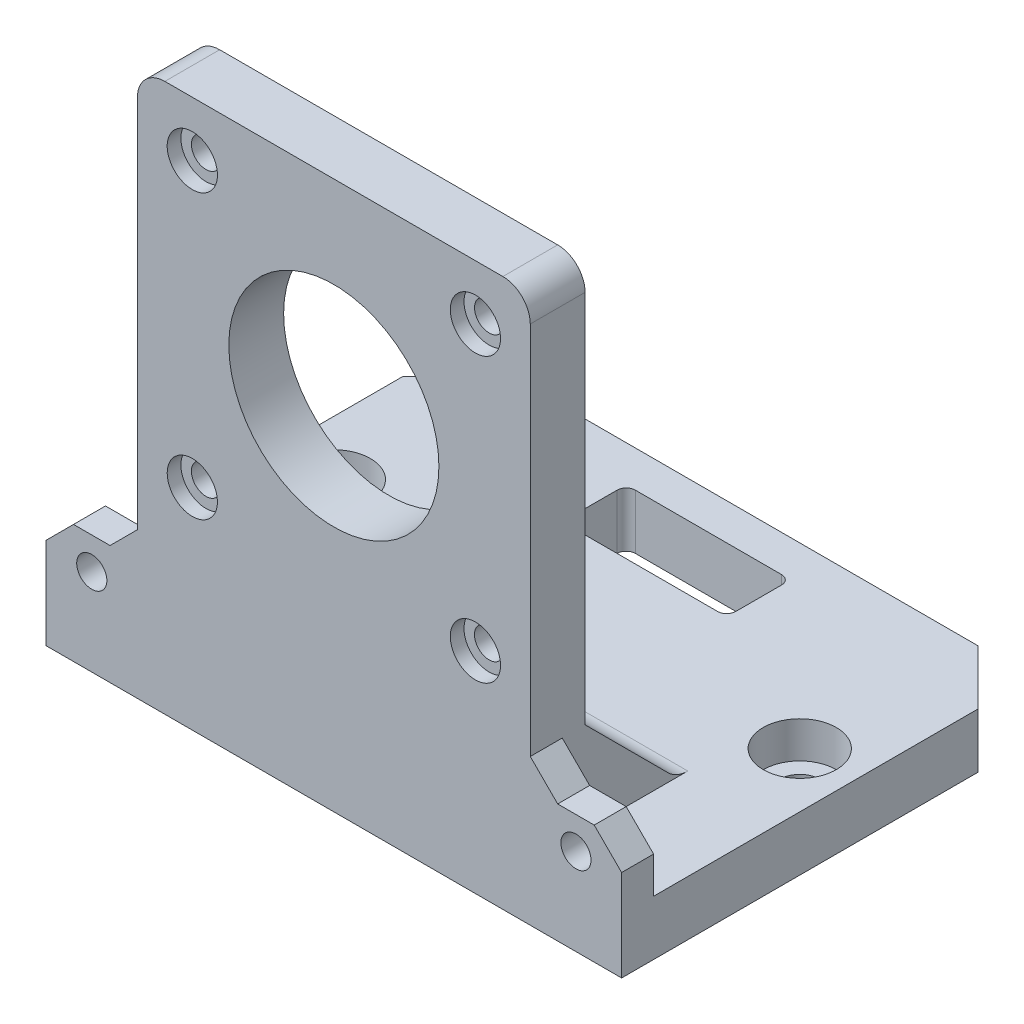
from build123d import *

# Parameters (mm, degrees)
SKETCH1_W           = 43
SKETCH1_H           = 54
SKETCH1_R           = 1.6
SKETCH1_R_2         = 11.5
BOSS_EXTRUDE1_DEPTH = 6
FILLET1_R           = 3
SKETCH2_W           = 63
SKETCH2_H           = 45
BOSS_EXTRUDE2_DEPTH = 6
SKETCH3_R           = 2.2
CUT_EXTRUDE1_DEPTH  = 10
CHAMFER6_SIZE       = 10
SKETCH7_R           = 2.75
CUT_EXTRUDE4_DEPTH  = 1.5
CHAMFER11_SIZE      = 6
SKETCH13_W          = 10
SKETCH13_H          = 3.5
BOSS_EXTRUDE7_DEPTH = 7
SKETCH14_R          = 1.65
CUT_EXTRUDE5_DEPTH  = 7
SKETCH15_W          = 18
SKETCH15_H          = 7
CUT_EXTRUDE6_DEPTH  = 7
FILLET9_R           = 1
FILLET10_R          = 3
SKETCH16_R          = 4
CUT_EXTRUDE7_DEPTH  = 4
CHAMFER12_SIZE      = 3


with BuildPart() as part:
    # Sketch1 → Boss-Extrude1 (new body)
    with BuildSketch(Plane.XY):
        with Locations((0, -5.5)):
            Rectangle(SKETCH1_W, SKETCH1_H)
        with Locations((-15.495, 15.495)):
            Circle(SKETCH1_R, mode=Mode.SUBTRACT)
        with Locations(Location((15.495, 15.495, 0), (0, 0, 180))):
            Circle(SKETCH1_R, mode=Mode.SUBTRACT)
        with Locations((15.495, -15.495)):
            Circle(SKETCH1_R, mode=Mode.SUBTRACT)
        with Locations(Location((-15.495, -15.495, 0), (0, 0, 180))):
            Circle(SKETCH1_R, mode=Mode.SUBTRACT)
        Circle(SKETCH1_R_2, mode=Mode.SUBTRACT)
    extrude(amount=BOSS_EXTRUDE1_DEPTH)

    # Fillet1
    fillet1_edges = [part.edges().sort_by_distance(p)[0] for p in [
        (-21.5, 21.5, 3),
        (21.5, 21.5, 3),
    ]]
    fillet(fillet1_edges, radius=FILLET1_R)

    # Sketch2 → Boss-Extrude2 (add)
    with BuildSketch(Plane.XZ.offset(32.5)):
        with Locations((0, -16.5)):
            Rectangle(SKETCH2_W, SKETCH2_H)
    extrude(amount=BOSS_EXTRUDE2_DEPTH)

    # Sketch3 → Cut-Extrude1 (cut)
    with BuildSketch(Plane(origin=(0, -32.5, 0), x_dir=(1, 0, 0), z_dir=(0, 1, 0))):
        with Locations(Location((-25.5, 19.5, 0), (0, 0, 270))):
            Circle(SKETCH3_R)
        with Locations(Location((25.5, 19.5, 0), (0, 0, 90))):
            Circle(SKETCH3_R)
    extrude(amount=-CUT_EXTRUDE1_DEPTH, mode=Mode.SUBTRACT)

    # Chamfer6
    chamfer6_edges = [part.edges().sort_by_distance(p)[0] for p in [
        (0, -32.5, 0),
    ]]
    chamfer(chamfer6_edges, length=CHAMFER6_SIZE)

    # Sketch7 → Cut-Extrude4 (cut)
    with BuildSketch(Plane.XY.offset(6)):
        with Locations((-15.495, 15.495)):
            Circle(SKETCH7_R)
        with Locations(Location((15.495, 15.495, 0), (0, 0, 180))):
            Circle(SKETCH7_R)
        with Locations((15.495, -15.495)):
            Circle(SKETCH7_R)
        with Locations(Location((-15.495, -15.495, 0), (0, 0, 180))):
            Circle(SKETCH7_R)
    extrude(amount=-CUT_EXTRUDE4_DEPTH, mode=Mode.SUBTRACT)

    # Chamfer11
    chamfer11_edges = [part.edges().sort_by_distance(p)[0] for p in [
        (-31.5, -35.5, -39),
        (31.5, -35.5, -39),
    ]]
    chamfer(chamfer11_edges, length=CHAMFER11_SIZE)

    # Sketch13 → Boss-Extrude7 (add)
    with BuildSketch(Plane(origin=(0, -32.5, 0), x_dir=(1, 0, 0), z_dir=(0, 1, 0))):
        with Locations((-26.5, -4.25)):
            Rectangle(SKETCH13_W, SKETCH13_H)
        with Locations((26.5, -4.25)):
            Rectangle(SKETCH13_W, SKETCH13_H)
    extrude(amount=BOSS_EXTRUDE7_DEPTH)

    # Sketch14 → Cut-Extrude5 (cut)
    with BuildSketch(Plane.XY.offset(6)):
        with Locations((-26.5, -29)):
            Circle(SKETCH14_R)
        with Locations((26.5, -29)):
            Circle(SKETCH14_R)
    extrude(amount=-CUT_EXTRUDE5_DEPTH, mode=Mode.SUBTRACT)

    # Sketch15 → Cut-Extrude6 (cut)
    with BuildSketch(Plane(origin=(0, -32.5, 0), x_dir=(1, 0, 0), z_dir=(0, 1, 0))):
        with Locations((0, 31.5)):
            Rectangle(SKETCH15_W, SKETCH15_H)
    extrude(amount=-CUT_EXTRUDE6_DEPTH, mode=Mode.SUBTRACT)

    # Fillet9
    fillet9_edges = [part.edges().sort_by_distance(p)[0] for p in [
        (9, -35.5, -35),
        (9, -35.5, -28),
        (-9, -35.5, -28),
        (-9, -35.5, -35),
    ]]
    fillet(fillet9_edges, radius=FILLET9_R)

    # Fillet10
    fillet10_edges = [part.edges().sort_by_distance(p)[0] for p in [
        (0, -32.5, -10),
    ]]
    fillet(fillet10_edges, radius=FILLET10_R)

    # Sketch16 → Cut-Extrude7 (cut)
    with BuildSketch(Plane(origin=(0, -32.5, 0), x_dir=(1, 0, 0), z_dir=(0, 1, 0))):
        with Locations(Location((-25.5, 19.5, 0), (0, 0, 270))):
            Circle(SKETCH16_R)
        with Locations(Location((25.5, 19.5, 0), (0, 0, 270))):
            Circle(SKETCH16_R)
    extrude(amount=-CUT_EXTRUDE7_DEPTH, mode=Mode.SUBTRACT)

    # Chamfer12
    chamfer12_edges = [part.edges().sort_by_distance(p)[0] for p in [
        (-31.5, -25.5, 4.25),
        (-21.5, -25.5, 4.25),
        (31.5, -25.5, 4.25),
        (21.5, -25.5, 4.25),
    ]]
    chamfer(chamfer12_edges, length=CHAMFER12_SIZE)


solid = part.part
